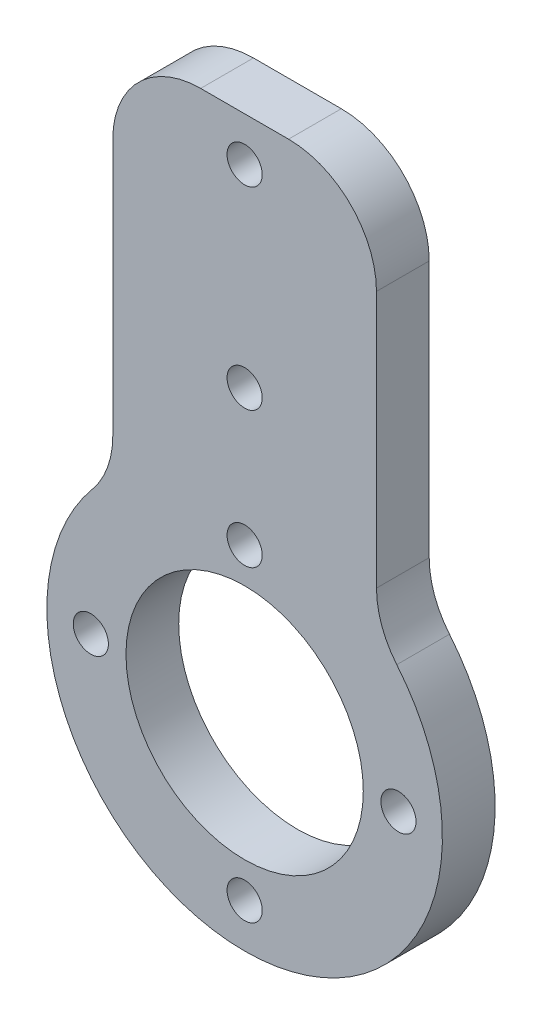
from build123d import *

# Parameters (mm, degrees)
SKETCH1_R           = 2
SKETCH1_R_2         = 13.5
BOSS_EXTRUDE1_DEPTH = 3
FILLET1_R           = 10


with BuildPart() as part:
    # Sketch1 → Boss-Extrude1 (new, symmetric)
    with BuildSketch(Plane.XY):
        with BuildLine():
            Line((15, 60), (-15, 60))
            Line((-15, 60), (-15, 16.770509831))
            ThreePointArc((-15, 16.770509831), (0, -22.5), (15, 16.770509831))
            Line((15, 16.770509831), (15, 60))
        make_face()
        with Locations((0, 33)):
            Circle(SKETCH1_R, mode=Mode.SUBTRACT)
        with Locations((0, 55)):
            Circle(SKETCH1_R, mode=Mode.SUBTRACT)
        with Locations((17.5, 0)):
            Circle(SKETCH1_R, mode=Mode.SUBTRACT)
        with Locations((-17.5, 0)):
            Circle(SKETCH1_R, mode=Mode.SUBTRACT)
        with Locations((0, -17.5)):
            Circle(SKETCH1_R, mode=Mode.SUBTRACT)
        Circle(SKETCH1_R_2, mode=Mode.SUBTRACT)
        with Locations((0, 17.5)):
            Circle(SKETCH1_R, mode=Mode.SUBTRACT)
    extrude(amount=BOSS_EXTRUDE1_DEPTH, both=True)

    # Fillet1
    fillet1_edges = [part.edges().sort_by_distance(p)[0] for p in [
        (-15, 60, 0),
        (15, 60, 0),
        (15, 16.770509831, 0),
        (-15, 16.770509831, 0),
    ]]
    fillet(fillet1_edges, radius=FILLET1_R)


solid = part.part
